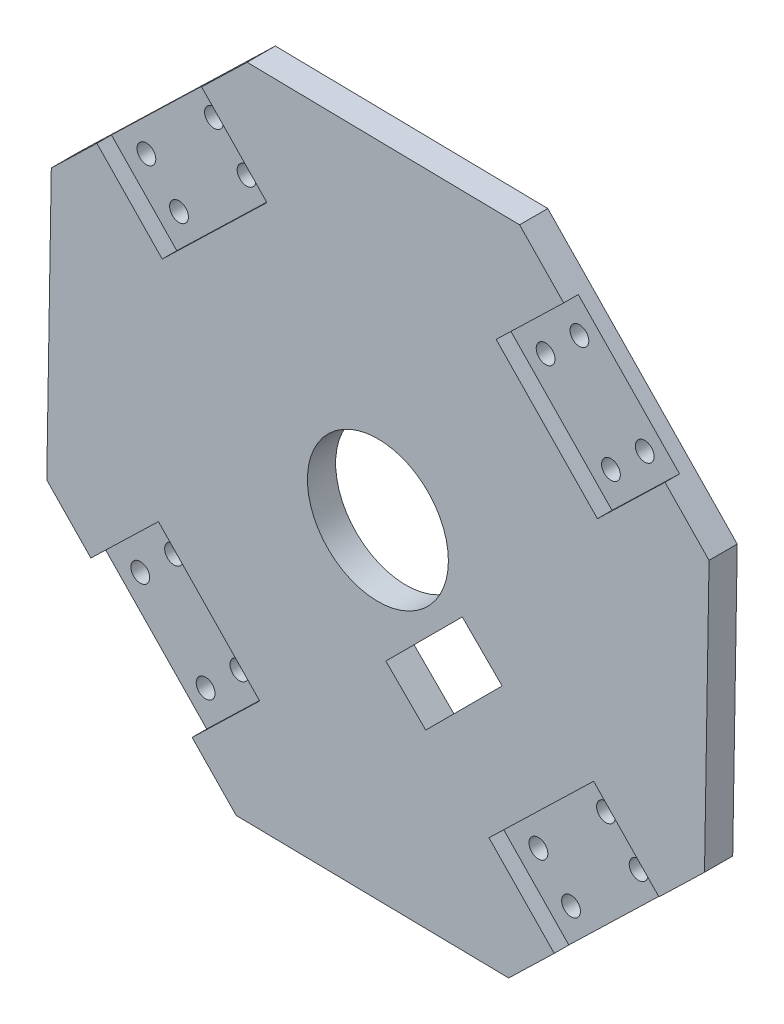
from build123d import *

# Parameters (mm, degrees)
RESSALTO_EXTRUS_O1_DEPTH = 6
CORTE_EXTRUS_O1_DEPTH    = 3.1
ESBO_O4_R                = 15
CORTE_EXTRUS_O2_DEPTH    = 100.844211363
ESBO_O6_R                = 2
CORTE_EXTRUS_O3_DEPTH    = 3.1
CORTE_EXTRUS_O7_DEPTH    = 10


with BuildPart() as part:
    # Esboço2 → Ressalto-extrusão1 (new body)
    with BuildSketch(Plane.XY):
        Polygon((70.472925804, 27.825776133), (30.15608873, 69.507678721), (-27.825776133, 70.472925804), (-69.507678721, 30.15608873), (-70.472925804, -27.825776133), (-30.15608873, -69.507678721), (27.825776133, -70.472925804), (69.507678721, -30.15608873), align=None)
    extrude(amount=RESSALTO_EXTRUS_O1_DEPTH)

    # Esboço3 → Corte-extrusão1 (cut)
    with BuildSketch(Plane.XY.offset(6)):
        Polygon((-61.0871998, -37.529288249), (-39.534791939, -59.811427182), (-25.159218434, -45.906647917), (-46.711626295, -23.624508984), align=None)
        Polygon((46.71864909, 23.617248408), (25.166241229, 45.899387341), (39.541814734, 59.804166606), (61.094222595, 37.522027673), align=None)
        Polygon((-59.804166606, 39.541814734), (-37.522027673, 61.094222595), (-23.617248408, 46.71864909), (-45.899387341, 25.166241229), align=None)
        Polygon((23.631531779, -46.718886871), (45.913670712, -25.16647901), (59.818449977, -39.542052515), (37.536311044, -61.094460376), align=None)
    extrude(amount=-CORTE_EXTRUS_O1_DEPTH, mode=Mode.SUBTRACT)

    # Esboço4 → Corte-extrusão2 (cut, through all)
    with BuildSketch(Plane.XY.offset(6)):
        Circle(ESBO_O4_R)
    extrude(amount=-CORTE_EXTRUS_O2_DEPTH, mode=Mode.SUBTRACT)

    # Esboço6 → Corte-extrusão3 (cut)
    with BuildSketch(Plane.XY.offset(2.9)):
        with Locations((-46.481705373, -31.053986514)):
            Circle(ESBO_O6_R)
        with Locations((-53.669492126, -38.006376147)):
            Circle(ESBO_O6_R)
        with Locations((-39.764712861, -52.381949652)):
            Circle(ESBO_O6_R)
        with Locations((-32.576926108, -45.429560019)):
            Circle(ESBO_O6_R)
        with Locations((39.779293109, 52.368949317)):
            Circle(ESBO_O6_R)
        with Locations((32.590503175, 45.417596982)):
            Circle(ESBO_O6_R)
        with Locations((53.681997779, 37.991369449)):
            Circle(ESBO_O6_R)
        with Locations((46.493207845, 31.040017114)):
            Circle(ESBO_O6_R)
        with Locations((38.006376147, -53.669492126)):
            Circle(ESBO_O6_R)
        with Locations((31.061009309, -46.488965949)):
            Circle(ESBO_O6_R)
        with Locations((52.381949652, -39.764712861)):
            Circle(ESBO_O6_R)
        with Locations((45.436582814, -32.584186684)):
            Circle(ESBO_O6_R)
        with Locations((-37.991369449, 53.681997779)):
            Circle(ESBO_O6_R)
        with Locations((-31.047038861, 46.500469435)):
            Circle(ESBO_O6_R)
        with Locations((-45.424618729, 32.597764765)):
            Circle(ESBO_O6_R)
        with Locations((-52.368949317, 39.779293109)):
            Circle(ESBO_O6_R)
    extrude(amount=-CORTE_EXTRUS_O3_DEPTH, mode=Mode.SUBTRACT)

    # Esboço7 → Corte-extrusão7 (cut)
    with BuildSketch(Plane.XY.offset(6)):
        Polygon((10.173878015, -33.609114275), (1.688596641, -25.123832901), (17.952052608, -8.860376934), (26.437333982, -17.345658308), align=None)
    extrude(amount=-CORTE_EXTRUS_O7_DEPTH, mode=Mode.SUBTRACT)


solid = part.part
